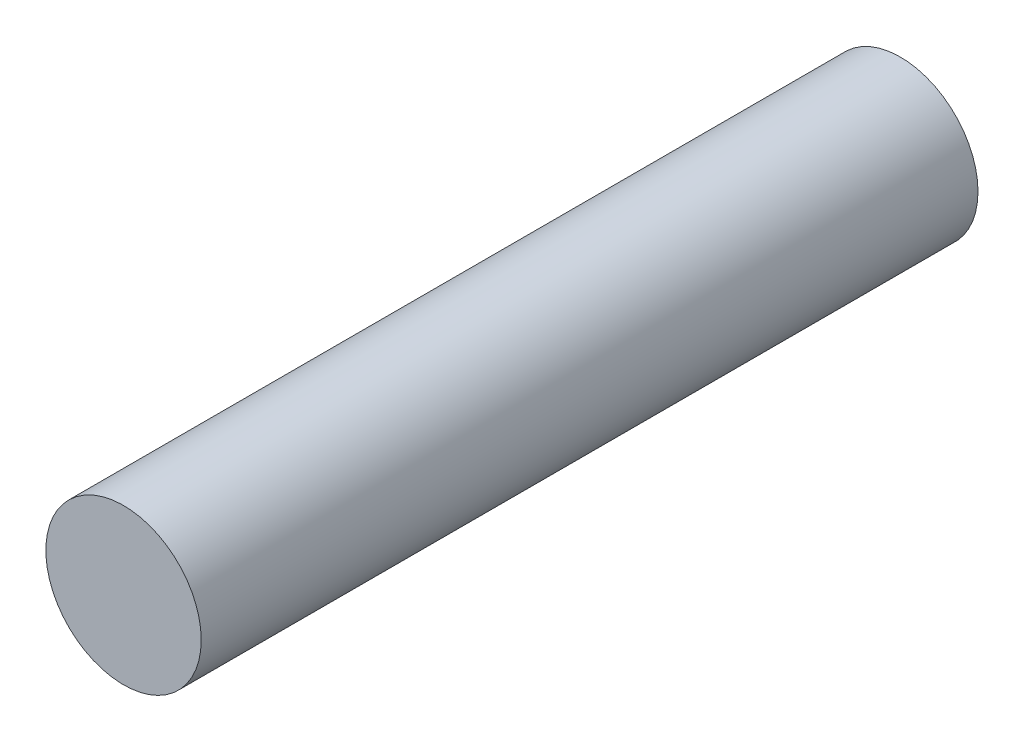
from build123d import *

# Parameters (mm, degrees)
SKETCH2_R           = 7.5
BOSS_EXTRUDE1_DEPTH = 75


with BuildPart() as part:
    # Sketch2 → Boss-Extrude1 (new body)
    with BuildSketch(Plane.XY):
        Circle(SKETCH2_R)
    extrude(amount=BOSS_EXTRUDE1_DEPTH)


solid = part.part
